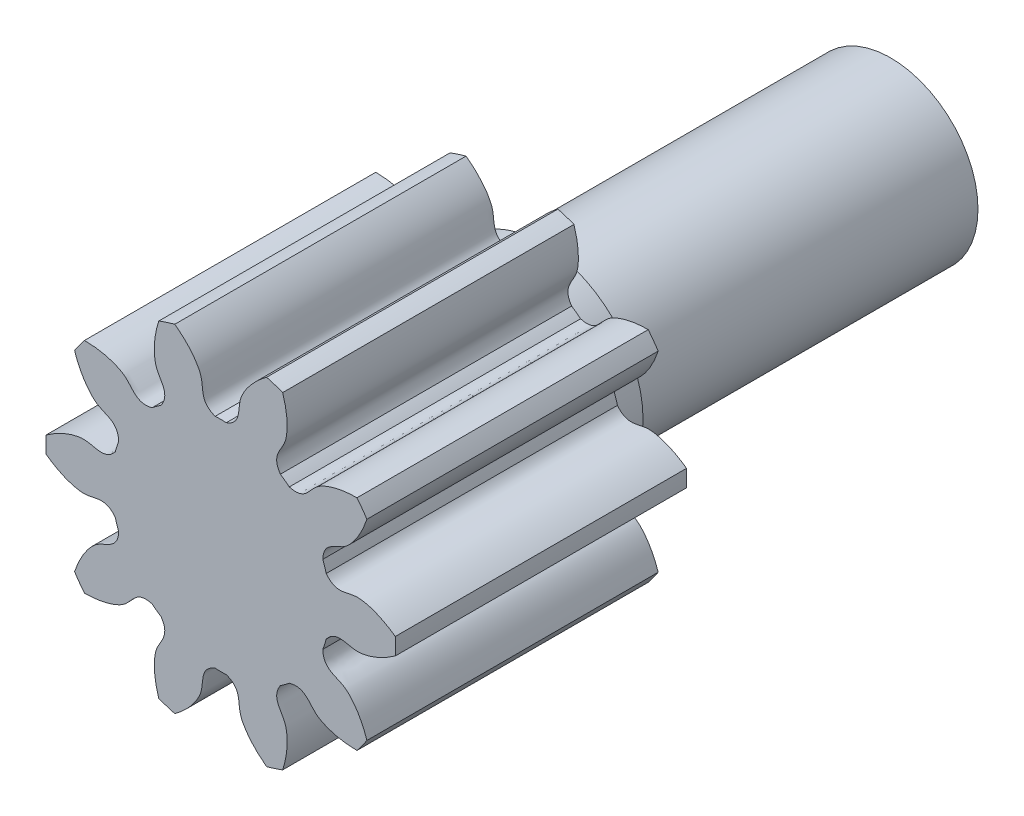
from build123d import *

# Parameters (mm, degrees)
SKETCH_1_R               = 6
EXTRUDE_1_DEPTH          = 10
CUT_EXTRUDE_1_DEPTH      = 14.114877049
PATTERN_CIRCULAR_1_COUNT = 10
SKETCH_4_R               = 3
EXTRUDE_2_DEPTH          = 13
SKETCH_5_R               = 3.5
EXTRUDE_3_DEPTH          = 1


with BuildPart() as part:
    # 草图1 → 凸台-拉伸1 (new body)
    with BuildSketch(Plane.XY):
        Circle(SKETCH_1_R)
    extrude(amount=EXTRUDE_1_DEPTH)

    # 草图2 → 切除-拉伸1 (cut, through all)
    with BuildSketch(Plane.XY):
        with BuildLine():
            ThreePointArc((0.190458265, 3.745160297), (0, 3.75), (-0.190458265, 3.745160297))
            add(Edge.make_bspline(
                [(-0.190458265, 3.745160297), (-0.725430331, 3.940568186), (-0.573841554, 4.370589445), (-0.688661607, 4.724672554), (-0.694503029, 4.741544901), (-0.701331269, 4.760060529), (-0.70921268, 4.780186334), (-0.718214569, 4.801886798), (-0.728402645, 4.825124493), (-0.739841734, 4.849859955), (-0.752595488, 4.876051763), (-0.766726409, 4.903656551), (-0.782295769, 4.932629042), (-0.799363569, 4.962922084), (-0.817988486, 4.994486675), (-0.838227824, 5.027272005), (-0.860137463, 5.061225487), (-0.883771816, 5.096292795), (-0.909183774, 5.132417902), (-0.936424669, 5.169543121), (-0.965544222, 5.207609142), (-0.996590502, 5.246555077), (-1.029609881, 5.286318499), (-1.064646996, 5.32683549), (-1.101744703, 5.368040681), (-1.140944039, 5.409867302), (-1.182284184, 5.452247226), (-1.225802423, 5.495111018), (-1.27153411, 5.538387984), (-1.319512632, 5.582006221), (-1.369769373, 5.625892664), (-1.422333687, 5.669973145), (-1.47723286, 5.714172436), (-1.534492084, 5.758414311), (-1.594134426, 5.802621591), (-1.656180802, 5.846716209), (-1.720649949, 5.890619254), (-1.7875584, 5.934251038), (-1.856920464, 5.977531144), (-1.928748198, 6.020378489), (-2.003051392, 6.062711377), (-2.079837546, 6.104447565), (-2.159111853, 6.145504313), (-2.240877184, 6.185798451), (-2.32513407, 6.225246433), (-2.411880692, 6.263764402), (-2.501112866, 6.30126825), (-2.592824034, 6.337673675), (-2.687005256, 6.372896249), (-2.7836452, 6.406851474), (-2.882730137, 6.439454848), (-2.984243937, 6.470621922), (-3.088168067, 6.500268371), (-3.194481586, 6.528310046), (-3.303161149, 6.554663046), (-3.414181007, 6.579243773), (-3.527513011, 6.601969001), (-3.643126614, 6.622755934), (-3.760988883, 6.641522271), (-3.881064493, 6.658186268), (-4.045310507, 6.677641021), (-4.169834901, 6.688586939), (-4.253586627, 6.6942889)],
                knots=[0, 0, 0, 0, 0.201720712, 0.204696754, 0.208022917, 0.211699204, 0.215725612, 0.220102144, 0.224828797, 0.229905574, 0.235332472, 0.241109493, 0.247236637, 0.253713903, 0.260541292, 0.267718803, 0.275246437, 0.283124193, 0.291352071, 0.299930073, 0.308858196, 0.318136442, 0.327764811, 0.337743302, 0.348071916, 0.358750652, 0.36977951, 0.381158491, 0.392887595, 0.404966821, 0.41739617, 0.430175641, 0.443305234, 0.45678495, 0.470614789, 0.48479475, 0.499324833, 0.514205039, 0.529435368, 0.545015819, 0.560946392, 0.577227088, 0.593857907, 0.610838848, 0.628169911, 0.645851097, 0.663882406, 0.682263837, 0.70099539, 0.720077066, 0.739508864, 0.759290785, 0.779422829, 0.799904995, 0.820737283, 0.841919694, 0.863452227, 0.885334883, 0.907567662, 0.930150562, 0.953083586, 1, 1, 1, 1], degree=3))
            ThreePointArc((-4.253586627, 6.6942889), (0, 7.931361993), (4.253586627, 6.6942889))
            add(Edge.make_bspline(
                [(0.190458265, 3.745160297), (0.725430331, 3.940568186), (0.573841554, 4.370589445), (0.688661607, 4.724672554), (0.694503029, 4.741544901), (0.701331269, 4.760060529), (0.70921268, 4.780186334), (0.718214569, 4.801886798), (0.728402645, 4.825124493), (0.739841734, 4.849859955), (0.752595488, 4.876051763), (0.766726409, 4.903656551), (0.782295769, 4.932629042), (0.799363569, 4.962922084), (0.817988486, 4.994486675), (0.838227824, 5.027272005), (0.860137463, 5.061225487), (0.883771816, 5.096292795), (0.909183774, 5.132417902), (0.936424669, 5.169543121), (0.965544222, 5.207609142), (0.996590502, 5.246555077), (1.029609881, 5.286318499), (1.064646996, 5.32683549), (1.101744703, 5.368040681), (1.140944039, 5.409867302), (1.182284184, 5.452247226), (1.225802423, 5.495111018), (1.27153411, 5.538387984), (1.319512632, 5.582006221), (1.369769373, 5.625892664), (1.422333687, 5.669973145), (1.47723286, 5.714172436), (1.534492084, 5.758414311), (1.594134426, 5.802621591), (1.656180802, 5.846716209), (1.720649949, 5.890619254), (1.7875584, 5.934251038), (1.856920464, 5.977531144), (1.928748198, 6.020378489), (2.003051392, 6.062711377), (2.079837546, 6.104447565), (2.159111853, 6.145504313), (2.240877184, 6.185798451), (2.32513407, 6.225246433), (2.411880692, 6.263764402), (2.501112866, 6.30126825), (2.592824034, 6.337673675), (2.687005256, 6.372896249), (2.7836452, 6.406851474), (2.882730137, 6.439454848), (2.984243937, 6.470621922), (3.088168067, 6.500268371), (3.194481586, 6.528310046), (3.303161149, 6.554663046), (3.414181007, 6.579243773), (3.527513011, 6.601969001), (3.643126614, 6.622755934), (3.760988883, 6.641522271), (3.881064493, 6.658186268), (4.045310507, 6.677641021), (4.169834901, 6.688586939), (4.253586627, 6.6942889)],
                knots=[0, 0, 0, 0, 0.201720712, 0.204696754, 0.208022917, 0.211699204, 0.215725612, 0.220102144, 0.224828797, 0.229905574, 0.235332472, 0.241109493, 0.247236637, 0.253713903, 0.260541292, 0.267718803, 0.275246437, 0.283124193, 0.291352071, 0.299930073, 0.308858196, 0.318136442, 0.327764811, 0.337743302, 0.348071916, 0.358750652, 0.36977951, 0.381158491, 0.392887595, 0.404966821, 0.41739617, 0.430175641, 0.443305234, 0.45678495, 0.470614789, 0.48479475, 0.499324833, 0.514205039, 0.529435368, 0.545015819, 0.560946392, 0.577227088, 0.593857907, 0.610838848, 0.628169911, 0.645851097, 0.663882406, 0.682263837, 0.70099539, 0.720077066, 0.739508864, 0.759290785, 0.779422829, 0.799904995, 0.820737283, 0.841919694, 0.863452227, 0.885334883, 0.907567662, 0.930150562, 0.953083586, 1, 1, 1, 1], degree=3))
        make_face()
    cut_extrude_1 = extrude(amount=CUT_EXTRUDE_1_DEPTH, mode=Mode.SUBTRACT)

    # 阵列(圆周)1: 切除-拉伸1 ×10 about axis
    pattern_circular_1_axis = Axis((0, 0, -0.5), (0, 0, 1))
    for i in range(1, PATTERN_CIRCULAR_1_COUNT):
        add(cut_extrude_1.rotate(pattern_circular_1_axis, i * 360 / PATTERN_CIRCULAR_1_COUNT), mode=Mode.SUBTRACT)

    # 草图4 → 凸台-拉伸2 (add)
    with BuildSketch(Plane(origin=(0, 0, 0), x_dir=(-1, 0, 0), z_dir=(0, 0, -1))):
        Circle(SKETCH_4_R)
    extrude(amount=EXTRUDE_2_DEPTH)

    # 草图5 → 凸台-拉伸3 (add)
    with BuildSketch(Plane(origin=(0, 0, 0), x_dir=(-1, 0, 0), z_dir=(0, 0, -1))):
        Circle(SKETCH_5_R)
    extrude(amount=EXTRUDE_3_DEPTH)


solid = part.part
